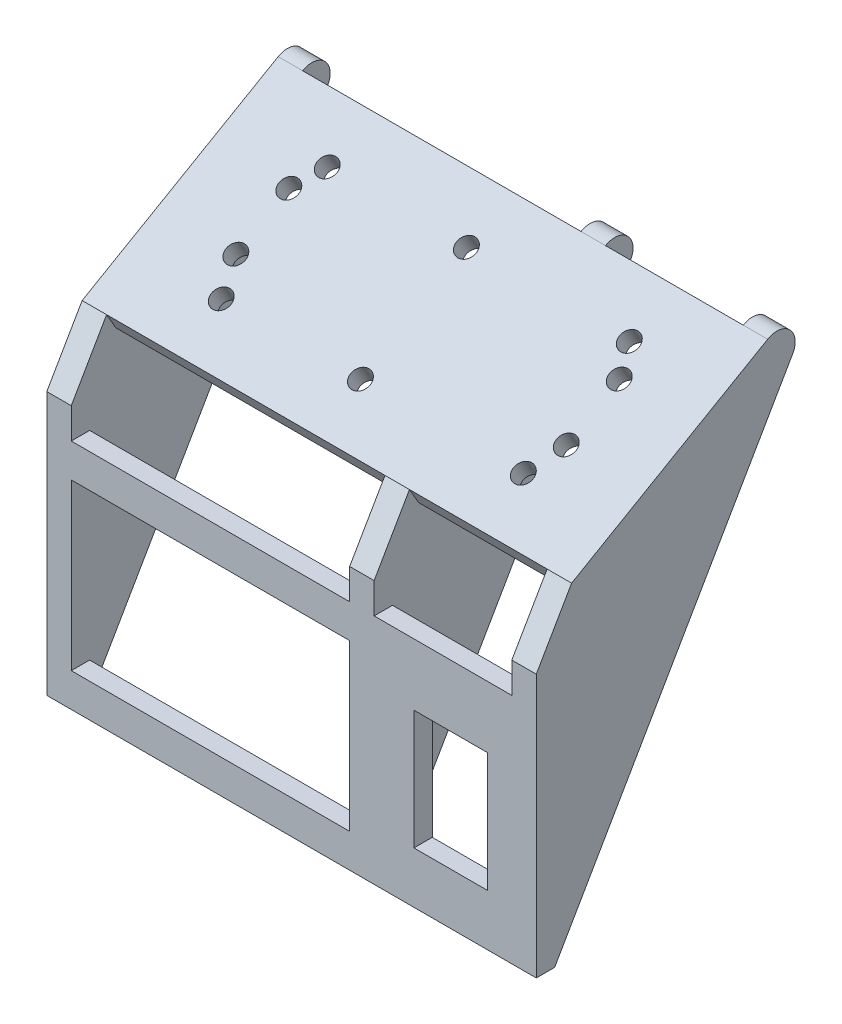
from build123d import *

# Parameters (mm, degrees)
SKETCH_1_W          = 80
SKETCH_1_H          = 38
SKETCH_1_W_2        = 45.5
SKETCH_1_H_2        = 27
SKETCH_1_W_3        = 12
SKETCH_1_H_3        = 19.5
EXTRUDE_1_DEPTH     = 3
EXTRUDE_2_DEPTH     = 4
EXTRUDE_START       = -49.5
EXTRUDE_3_DEPTH     = 4
EXTRUDE_START_2     = -76
EXTRUDE_4_DEPTH     = 4
SKETCH_6_W          = 80
SKETCH_6_H          = 37
EXTRUDE_5_DEPTH     = 3
SKETCH_7_R          = 1.6
CUT_EXTRUDE_1_DEPTH = 80.501880139


with BuildPart() as part:
    # 草图1 → 凸台-拉伸1 (new body)
    with BuildSketch(Plane.XY):
        Rectangle(SKETCH_1_W, SKETCH_1_H)
        with Locations((-13.25, 0)):
            Rectangle(SKETCH_1_W_2, SKETCH_1_H_2, mode=Mode.SUBTRACT)
        with Locations((26, -0.838945713)):
            Rectangle(SKETCH_1_W_3, SKETCH_1_H_3, mode=Mode.SUBTRACT)
    extrude(amount=EXTRUDE_1_DEPTH)

    # 草图3 → 凸台-拉伸2 (add)
    with BuildSketch(Plane.ZY.offset(40)):
        with BuildLine():
            Line((3, 19), (3, 24))
            Line((3, 24), (-2.773502692, 34))
            Line((-2.773502692, 34), (-34.816442632, 52.5))
            ThreePointArc((-34.816442632, 52.5), (-38.437762975, 52.023244132), (-38.914518843, 48.401923789))
            Line((-38.914518843, 48.401923789), (0, -19))
            Line((0, -19), (0, 19))
            Line((0, 19), (3, 19))
        make_face()
    extrude(amount=-EXTRUDE_2_DEPTH)

    # 草图4 → 凸台-拉伸3 (add)
    with BuildSketch(Plane.ZY.offset(40).offset(EXTRUDE_START)):
        with BuildLine():
            Line((-38.914518843, 48.401923789), (0, -19))
            Line((0, -19), (3, -19))
            Line((3, -19), (3, 24))
            Line((3, 24), (-2.773502692, 34))
            Line((-2.773502692, 34), (-34.816442632, 52.5))
            ThreePointArc((-34.816442632, 52.5), (-38.437762975, 52.023244132), (-38.914518843, 48.401923789))
        make_face()
    extrude(amount=-EXTRUDE_3_DEPTH)

    # 草图5 → 凸台-拉伸4 (add)
    with BuildSketch(Plane.ZY.offset(40).offset(EXTRUDE_START_2)):
        with BuildLine():
            Line((-38.914518843, 48.401923789), (0, -19))
            Line((0, -19), (3, -19))
            Line((3, -19), (3, 24))
            Line((3, 24), (-2.773502692, 34))
            Line((-2.773502692, 34), (-34.816442632, 52.5))
            ThreePointArc((-34.816442632, 52.5), (-38.437762975, 52.023244132), (-38.914518843, 48.401923789))
        make_face()
    extrude(amount=-EXTRUDE_4_DEPTH)

    # 草图6 → 凸台-拉伸5 (add)
    with BuildSketch(Plane(origin=(0, 24.299038106, 14.029056191), x_dir=(1, 0, 0), z_dir=(0, 0.86602540378444, 0.4999999999999976))):
        with Locations((0, 37.901923789)):
            Rectangle(SKETCH_6_W, SKETCH_6_H)
    extrude(amount=-EXTRUDE_5_DEPTH)

    # 草图7 → 切除-拉伸1 (cut, through all)
    with BuildSketch(Plane(origin=(0, 24.299038106, 14.029056191), x_dir=(1, 0, 0), z_dir=(0, 0.86602540378444, 0.4999999999999975))):
        with Locations(Location((-24.625, 47.901923789, 0), (0, 0, 270))):
            Circle(SKETCH_7_R)
        with Locations(Location((-1.875, 47.901923789, 0), (0, 0, 270))):
            Circle(SKETCH_7_R)
        with Locations(Location((-1.875, 27.901923789, 0), (0, 0, 270))):
            Circle(SKETCH_7_R)
        with Locations(Location((-24.625, 27.901923789, 0), (0, 0, 270))):
            Circle(SKETCH_7_R)
        with Locations(Location((24.75, 47.901923789, 0), (0, 0, 270))):
            Circle(SKETCH_7_R)
        with Locations(Location((24.75, 27.901923789, 0), (0, 0, 270))):
            Circle(SKETCH_7_R)
        with Locations(Location((-27, 33.401923789, 0), (0, 0, 270))):
            Circle(SKETCH_7_R)
        with Locations(Location((27, 33.401923789, 0), (0, 0, 270))):
            Circle(SKETCH_7_R)
        with Locations(Location((-27, 43.401923789, 0), (0, 0, 270))):
            Circle(SKETCH_7_R)
        with Locations(Location((27, 43.401923789, 0), (0, 0, 270))):
            Circle(SKETCH_7_R)
    extrude(amount=-CUT_EXTRUDE_1_DEPTH, mode=Mode.SUBTRACT)


solid = part.part
